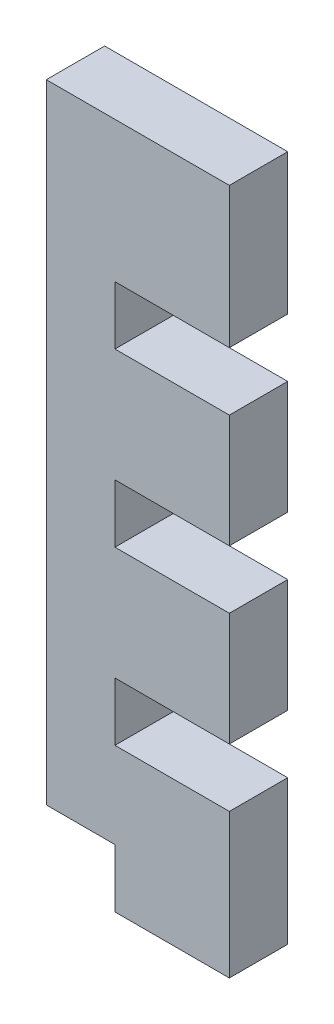
from build123d import *

# Parameters (mm, degrees)
BOSS_EXTRUDE1_DEPTH = 5.1


with BuildPart() as part:
    # Sketch1 → Boss-Extrude1 (new body)
    with BuildSketch(Plane.XY):
        Polygon((-8, -24.9), (-2, -24.9), (-2, -30), (8, -30), (8, -17.38834404), (-2, -17.38834404), (-2, -12.28834404), (8, -12.28834404), (8, -2.38834404), (-2, -2.38834404), (-2, 2.71165596), (8, 2.71165596), (8, 12.61165596), (-2, 12.61165596), (-2, 17.71165596), (8, 17.71165596), (8, 30), (-8, 30), align=None)
    extrude(amount=BOSS_EXTRUDE1_DEPTH)


solid = part.part
